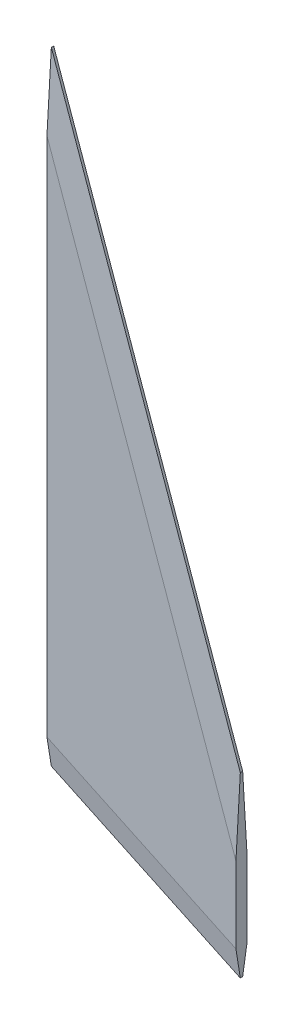
from build123d import *
from OCP.BRepFilletAPI import BRepFilletAPI_MakeChamfer

# Parameters (mm, degrees)
BOSS_EXTRUDE1_DEPTH = 1.5875
CHAMFER1_SIZE       = 1.25
CHAMFER1_SIZE2      = 7.089102275


with BuildPart() as part:
    # Sketch1 → Boss-Extrude1 (new, symmetric)
    with BuildSketch(Plane.XY):
        Polygon((-16.410036231, -60.699177334), (-16.410036231, 117.100822666), (37.564963769, -35.299177334), (37.564963769, -86.099177334), align=None)
    extrude(amount=BOSS_EXTRUDE1_DEPTH, both=True)

    # Chamfer1: one chamfer whose edges measure the first distance from different faces: ONE call of the kernel's chamfer builder (chamfer() names one face for all edges)
    chamfer1_edges_1 = [part.edges().sort_by_distance(p)[0] for p in [
        (10.577463769, 40.900822666, 1.5875),
        (10.577463769, 40.900822666, -1.5875),
    ]]
    chamfer1_side_1 = [part.faces().sort_by_distance(p)[0] for p in [
        (10.577463769, 40.900822666, 0),
    ]]
    chamfer1_edges_2 = [part.edges().sort_by_distance(p)[0] for p in [
        (10.577463769, -73.399177334, 1.5875),
        (10.577463769, -73.399177334, -1.5875),
    ]]
    chamfer1_side_2 = [part.faces().sort_by_distance(p)[0] for p in [
        (10.577463769, -73.399177334, 0),
    ]]
    chamfer1 = BRepFilletAPI_MakeChamfer(part.part.solid().wrapped)
    for e in chamfer1_edges_1:
        chamfer1.Add(CHAMFER1_SIZE, CHAMFER1_SIZE2, e.wrapped, chamfer1_side_1[0].wrapped)  # the first distance lies on this face
    for e in chamfer1_edges_2:
        chamfer1.Add(CHAMFER1_SIZE, CHAMFER1_SIZE2, e.wrapped, chamfer1_side_2[0].wrapped)  # the first distance lies on this face
    add(Compound.cast(chamfer1.Shape()), mode=Mode.REPLACE)


solid = part.part
